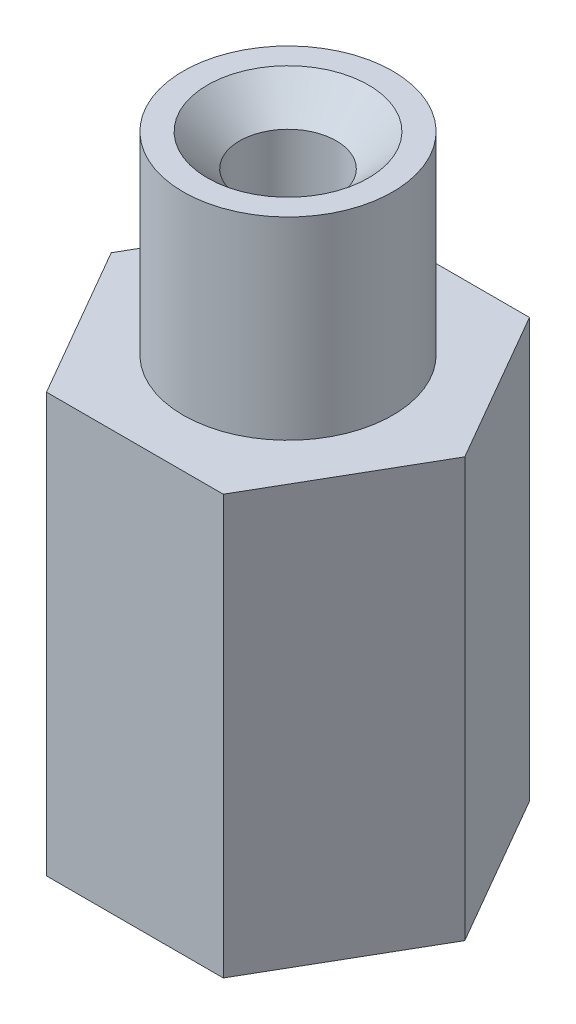
from build123d import *

# Parameters (mm, degrees)
DODANIE_WYCI_GNI_CIE1_DEPTH      = 9
DODANIE_WYCI_GNI_CIE1_DEPTH_BACK = 17
SZKIC1_R                         = 3
SZKIC1_3_R                       = 6.5
SZKIC1_3_R_2                     = 3
DODANIE_WYCI_GNI_CIE2_DEPTH      = 21
SFAZOWANIE1_SIZE                 = 2
SFAZOWANIE2_SIZE                 = 4
SZKIC3_R                         = 6
WYTNIJ_WYCI_GNI_CIE1_DEPTH       = 4
SFAZOWANIE3_SIZE                 = 1.5


with BuildPart() as part:
    # Szkic1 → Dodanie-wyciągnięcie1 (new, two sides: drawn at the far end of the back side and taken through both)
    with BuildSketch(Plane(origin=(0, 0, 0), x_dir=(1, 0, 0), z_dir=(0, 1, 0)).offset(-DODANIE_WYCI_GNI_CIE1_DEPTH_BACK)):
        Polygon((-5.484827557, 9.5), (-10.969655115, 0), (-5.484827557, -9.5), (5.484827557, -9.5), (10.969655115, 0), (5.484827557, 9.5), align=None)
        Circle(SZKIC1_R, mode=Mode.SUBTRACT)
    extrude(amount=DODANIE_WYCI_GNI_CIE1_DEPTH + DODANIE_WYCI_GNI_CIE1_DEPTH_BACK)

    # Szkic1<3> → Dodanie-wyciągnięcie2 (add)
    with BuildSketch(Plane(origin=(0, 0, 0), x_dir=(1, 0, 0), z_dir=(0, 1, 0))):
        Circle(SZKIC1_3_R)
        Circle(SZKIC1_3_R_2, mode=Mode.SUBTRACT)
    extrude(amount=DODANIE_WYCI_GNI_CIE2_DEPTH)

    # Sfazowanie1
    sfazowanie1_edges = [part.edges().sort_by_distance(p)[0] for p in [
        (-3, 21, 0),
    ]]
    chamfer(sfazowanie1_edges, length=SFAZOWANIE1_SIZE)

    # Sfazowanie2
    sfazowanie2_edges = [part.edges().sort_by_distance(p)[0] for p in [
        (-3, -17, 0),
    ]]
    chamfer(sfazowanie2_edges, length=SFAZOWANIE2_SIZE)

    # Szkic3 → Wytnij-wyciągnięcie1 (cut)
    with BuildSketch(Plane.XZ.offset(17)):
        Circle(SZKIC3_R)
    extrude(amount=-WYTNIJ_WYCI_GNI_CIE1_DEPTH, mode=Mode.SUBTRACT)

    # Sfazowanie3
    sfazowanie3_edges = [part.edges().sort_by_distance(p)[0] for p in [
        (-3, -13, 0),
    ]]
    chamfer(sfazowanie3_edges, length=SFAZOWANIE3_SIZE)


solid = part.part
